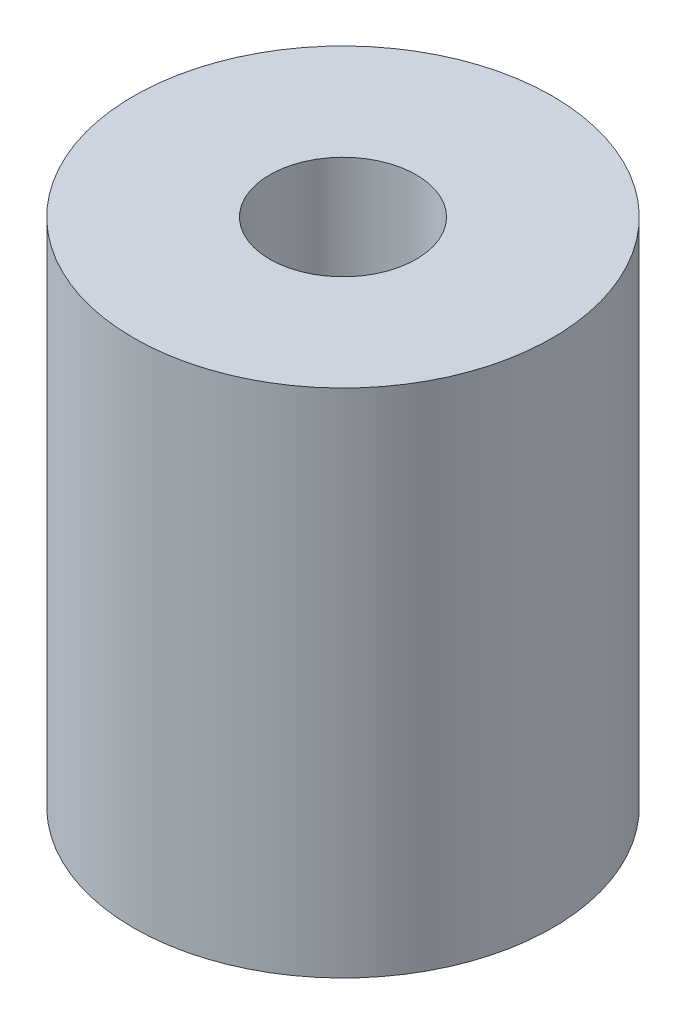
from build123d import *

# Parameters (mm, degrees)
SKETCH1_R           = 6.15
SKETCH1_R_2         = 2.15
BOSS_EXTRUDE1_DEPTH = 15


with BuildPart() as part:
    # Sketch1 → Boss-Extrude1 (new body)
    with BuildSketch(Plane(origin=(0, 0, 0), x_dir=(1, 0, 0), z_dir=(0, 1, 0))):
        with Locations(Location((0, 0, 0), (0, 0, 270))):
            Circle(SKETCH1_R)
        with Locations(Location((0, 0, 0), (0, 0, 270))):
            Circle(SKETCH1_R_2, mode=Mode.SUBTRACT)
    extrude(amount=BOSS_EXTRUDE1_DEPTH)


solid = part.part
